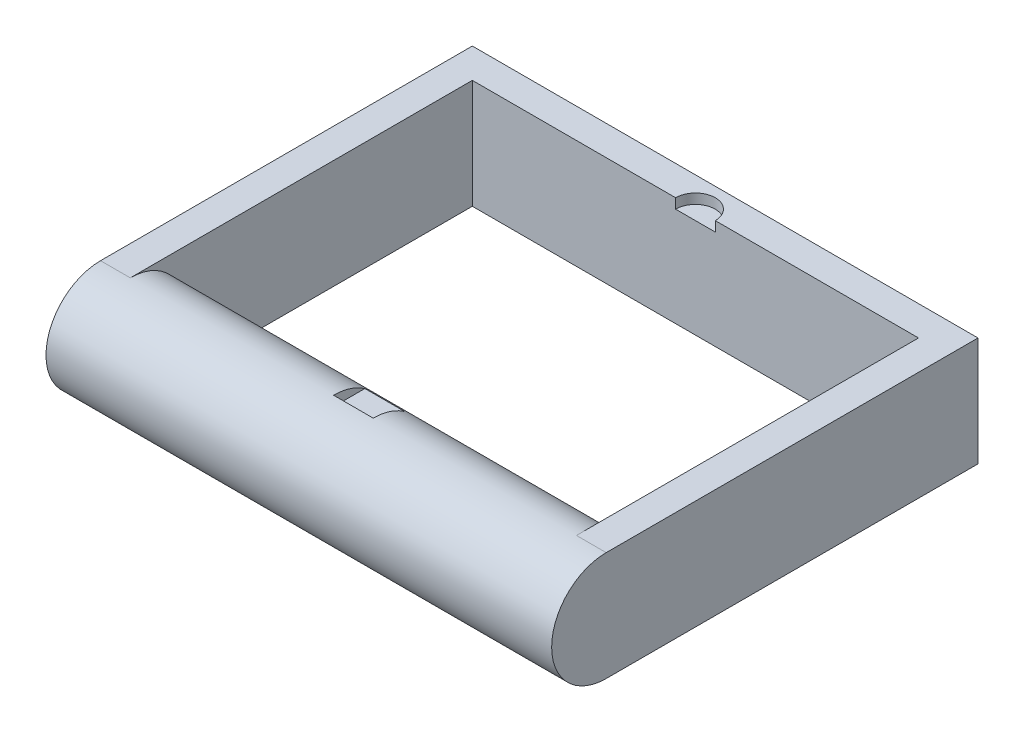
from build123d import *
from build123d.topology import SkipClean

# Parameters (mm, degrees)
SKETCH1_R           = 2.75
BOSS_EXTRUDE1_DEPTH = 22.5
BOSS_EXTRUDE2_START = 1.5
BOSS_EXTRUDE2_DEPTH = 1.5
BOSS_EXTRUDE3_DEPTH = 1.5
SKETCH5_W           = 25.5
SKETCH5_H           = 5.5
BOSS_EXTRUDE4_DEPTH = 1.5
CUT_EXTRUDE1_DEPTH  = 0.5


with BuildPart() as part:
    # Sketch1 → Boss-Extrude1 (new body)
    with BuildSketch(Plane(origin=(0, 0, 0), x_dir=(0, 0, -1), z_dir=(1, 0, 0))):
        with Locations(Location((0, 0, 0), (0, 0, 180))):
            Circle(SKETCH1_R)
    extrude(amount=BOSS_EXTRUDE1_DEPTH)

    # Sketch2 → Boss-Extrude2 (add)
    with SkipClean():  # the faces are left unmerged after this step: merging them gives an invalid solid
        with BuildSketch(Plane.ZY.offset(BOSS_EXTRUDE2_START)):
            with BuildLine():
                Line((0, 2.75), (-17.25, 2.75))
                Line((-17.25, 2.75), (-17.25, -2.75))
                Line((-17.25, -2.75), (0, -2.75))
                ThreePointArc((0, -2.75), (2.75, 0), (0, 2.75))
            make_face()
        extrude(amount=-BOSS_EXTRUDE2_DEPTH)

    # Sketch3 → Boss-Extrude3 (add)
    with BuildSketch(Plane(origin=(22.5, 0, 0), x_dir=(0, 0, -1), z_dir=(1, 0, 0))):
        with BuildLine():
            Line((0, -2.75), (17.25, -2.75))
            Line((17.25, -2.75), (17.25, 2.75))
            Line((17.25, 2.75), (0, 2.75))
            ThreePointArc((0, 2.75), (-2.75, 0), (0, -2.75))
        make_face()
    extrude(amount=BOSS_EXTRUDE3_DEPTH)

    # Sketch5 → Boss-Extrude4 (add)
    with BuildSketch(Plane(origin=(0, 0, -17.25), x_dir=(-1, 0, 0), z_dir=(0, 0, -1))):
        with Locations((-11.25, 0)):
            Rectangle(SKETCH5_W, SKETCH5_H)
    extrude(amount=BOSS_EXTRUDE4_DEPTH)

    # Sketch6 → Cut-Extrude1 (cut)
    with BuildSketch(Plane(origin=(0, 2.75, 0), x_dir=(1, 0, 0), z_dir=(0, 1, 0))):
        with BuildLine():
            Line((10.25, 17.25), (10.25, 0))
            Line((10.25, 0), (12.25, 0))
            Line((12.25, 0), (12.25, 17.25))
            ThreePointArc((12.25, 17.25), (11.25, 18.25), (10.25, 17.25))
        make_face()
    extrude(amount=-CUT_EXTRUDE1_DEPTH, mode=Mode.SUBTRACT)


solid = part.part
